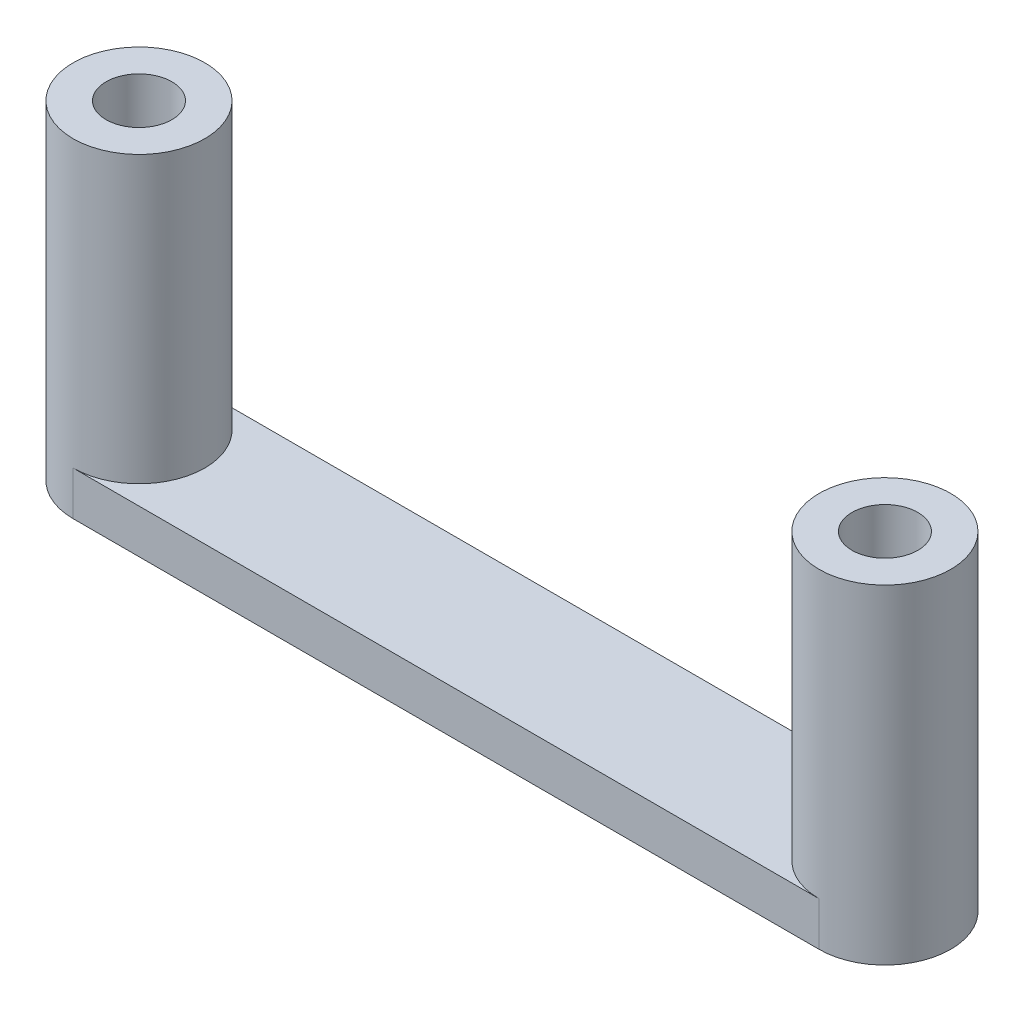
from build123d import *
from build123d.topology import SkipClean

# Parameters (mm, degrees)
EXTRUDE_1_DEPTH     = 2
EXTRUDE_2_DEPTH     = 13
SKETCH_4_R          = 1.5
CUT_EXTRUDE_1_DEPTH = 27.046428912
SKETCH_5_R          = 1.5
CUT_EXTRUDE_2_DEPTH = 27.046428912


with BuildPart() as part:
    # 草图1 → 凸台-拉伸1 (new body)
    with BuildSketch(Plane(origin=(0, 0, 0), x_dir=(1, 0, 0), z_dir=(0, 1, 0))):
        with BuildLine():
            Line((-15.918812675, 3), (18.081187325, 3))
            ThreePointArc((18.081187325, 3), (21.081187325, 0), (18.081187325, -3))
            Line((18.081187325, -3), (-15.918812675, -3))
            ThreePointArc((-15.918812675, -3), (-18.918812675, 0), (-15.918812675, 3))
        make_face()
    extrude(amount=EXTRUDE_1_DEPTH)

    # 草图2 → 凸台-拉伸2 (add)
    with SkipClean():  # the faces are left unmerged after this step: merging them gives an invalid solid
        with BuildSketch(Plane(origin=(0, 2, 0), x_dir=(1, 0, 0), z_dir=(0, 1, 0))):
            with BuildLine():
                ThreePointArc((-15.918812675, 3), (-18.918812675, 0), (-15.918812675, -3))
                ThreePointArc((-15.918812675, -3), (-13.797492331, -2.121320344), (-12.918812675, 0))
                ThreePointArc((-12.918812675, 0), (-13.797492331, 2.121320344), (-15.918812675, 3))
            make_face()
            with BuildLine():
                ThreePointArc((18.081187325, 3), (15.081187325, 0), (18.081187325, -3))
                ThreePointArc((18.081187325, -3), (20.202507669, -2.121320344), (21.081187325, 0))
                ThreePointArc((21.081187325, 0), (20.202507669, 2.121320344), (18.081187325, 3))
            make_face()
        extrude(amount=EXTRUDE_2_DEPTH)

    # 草图4 → 切除-拉伸1 (cut, through all)
    with SkipClean():  # the faces are left unmerged after this step: merging them gives an invalid solid
        with BuildSketch(Plane(origin=(0, 15, 0), x_dir=(1, 0, 0), z_dir=(0, 1, 0))):
            with Locations(Location((-15.918812675, 0, 0), (0, 0, 270))):
                Circle(SKETCH_4_R)
        extrude(amount=-CUT_EXTRUDE_1_DEPTH, mode=Mode.SUBTRACT)

    # 草图5 → 切除-拉伸2 (cut, through all)
    with SkipClean():  # the faces are left unmerged after this step: merging them gives an invalid solid
        with BuildSketch(Plane(origin=(0, 15, 0), x_dir=(1, 0, 0), z_dir=(0, 1, 0))):
            with Locations(Location((18.081187325, 0, 0), (0, 0, 270))):
                Circle(SKETCH_5_R)
        extrude(amount=-CUT_EXTRUDE_2_DEPTH, mode=Mode.SUBTRACT)


solid = part.part
